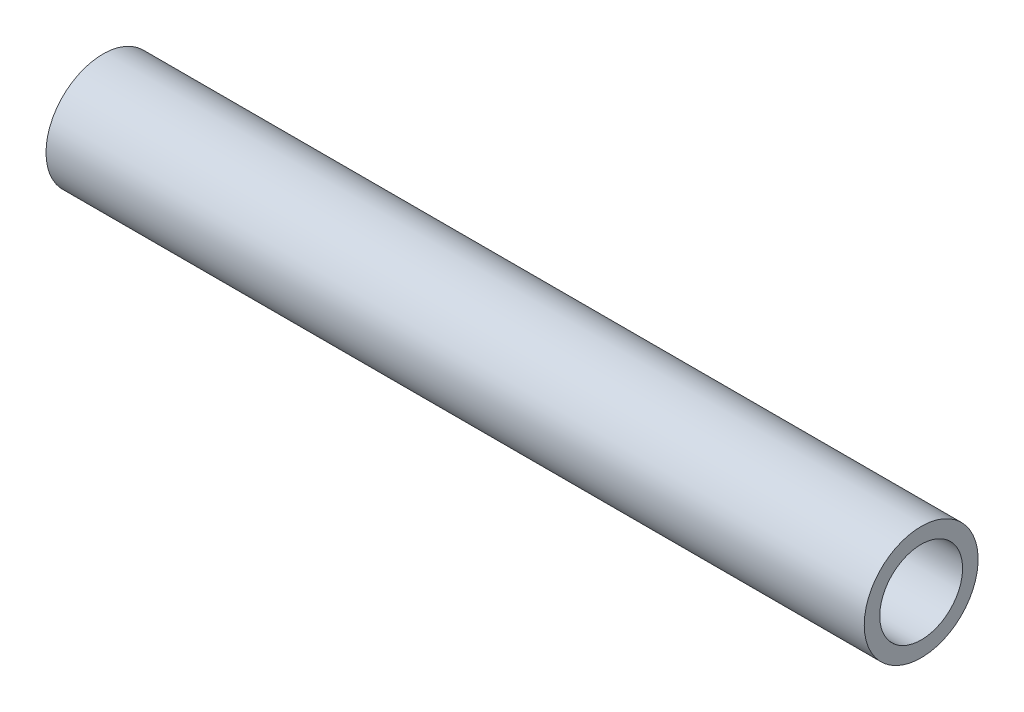
from build123d import *

# Parameters (mm, degrees)
CROQUIS1_R              = 16.7
CROQUIS1_R_2            = 12.15
SALIENTE_EXTRUIR1_DEPTH = 240


with BuildPart() as part:
    # Croquis1 → Saliente-Extruir1 (new body)
    with BuildSketch(Plane(origin=(0, 0, 0), x_dir=(0, 0, -1), z_dir=(1, 0, 0))):
        with Locations(Location((0, 0, 0), (0, 0, 180))):
            Circle(CROQUIS1_R)
        with Locations(Location((0, 0, 0), (0, 0, 180))):
            Circle(CROQUIS1_R_2, mode=Mode.SUBTRACT)
    extrude(amount=SALIENTE_EXTRUIR1_DEPTH)


solid = part.part
